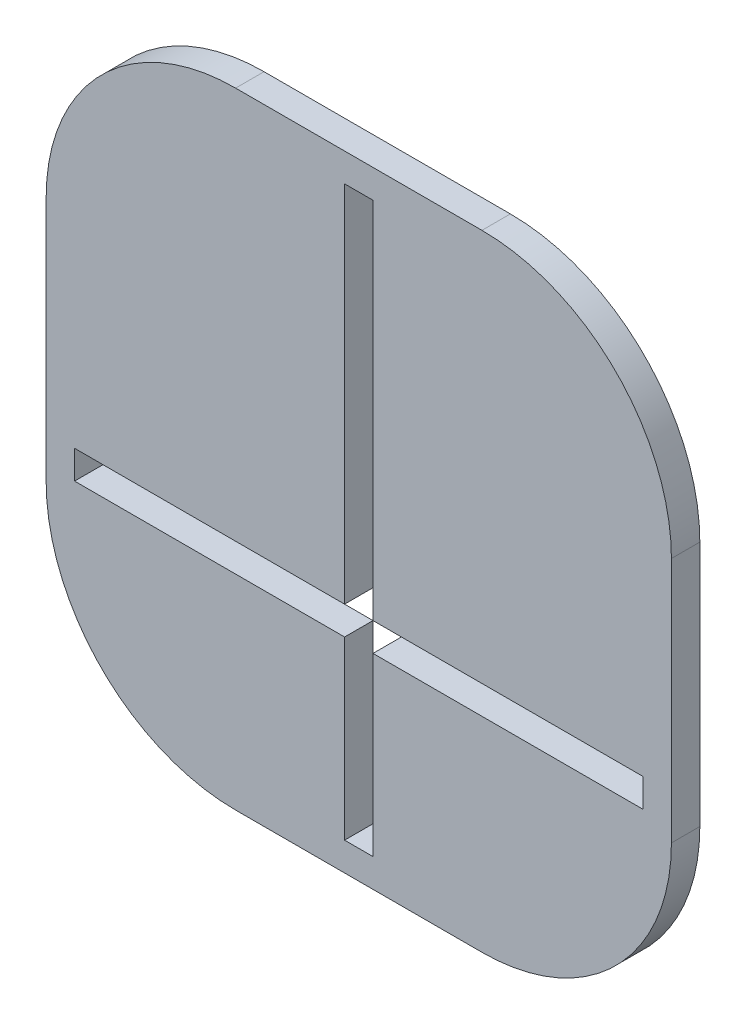
from build123d import *

# Parameters (mm, degrees)
SALIENTE_EXTRUIR1_DEPTH = 3


with BuildPart() as part:
    # Croquis1 → Saliente-Extruir1 (new body)
    with BuildSketch(Plane.XY):
        with BuildLine():
            Line((-13, -33), (13, -33))
            ThreePointArc((13, -33), (27.142135624, -27.142135624), (33, -13))
            Line((33, -13), (33, 13))
            ThreePointArc((33, 13), (27.142135624, 27.142135624), (13, 33))
            Line((13, 33), (-13, 33))
            ThreePointArc((-13, 33), (-27.142135624, 27.142135624), (-33, 13))
            Line((-33, 13), (-33, -13))
            ThreePointArc((-33, -13), (-27.142135624, -27.142135624), (-13, -33))
        make_face()
        Polygon((-30, -11.425), (-30, -8.425), (-1.5, -8.425), (-1.5, 30), (1.5, 30), (1.5, -8.425), (30, -8.425), (30, -11.425), (1.5, -11.425), (1.5, -30), (-1.5, -30), (-1.5, -11.425), align=None, mode=Mode.SUBTRACT)
    extrude(amount=SALIENTE_EXTRUIR1_DEPTH)


solid = part.part
